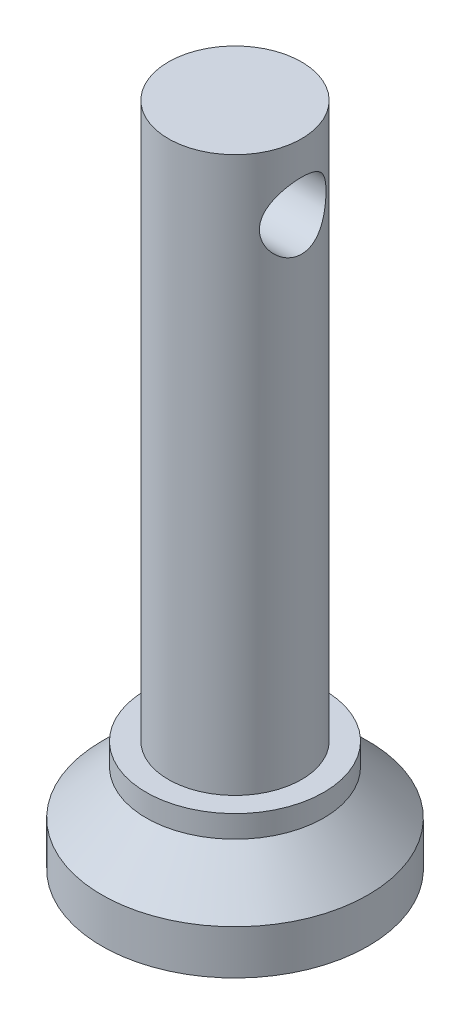
from build123d import *

# Parameters (mm, degrees)
CUT_EXTRUDE1_DEPTH      = 32.176914536
CUT_EXTRUDE1_DEPTH_BACK = 32.176914536
SKETCH3_R               = 1.5


with BuildPart() as part:
    # Sketch2 → Revolve2 (revolve)
    with BuildSketch(Plane.XY):
        Polygon((0, 0), (-6, 0), (-6, 2), (-4, 4), (-4, 5), (-3, 5), (-3, 30), (0, 30), align=None)
    revolve(axis=Axis((0, 30, 0), (0, -1, 0)))

    # Sketch3 → Cut-Extrude1 (cut, two sides: drawn at the far end of the back side and taken through both)
    with BuildSketch(Plane(origin=(0, 0, 0), x_dir=(0, 0, -1), z_dir=(1, 0, 0)).offset(-CUT_EXTRUDE1_DEPTH_BACK)):
        with Locations((0, 27)):
            Circle(SKETCH3_R)
    extrude(amount=CUT_EXTRUDE1_DEPTH + CUT_EXTRUDE1_DEPTH_BACK, mode=Mode.SUBTRACT)


solid = part.part
